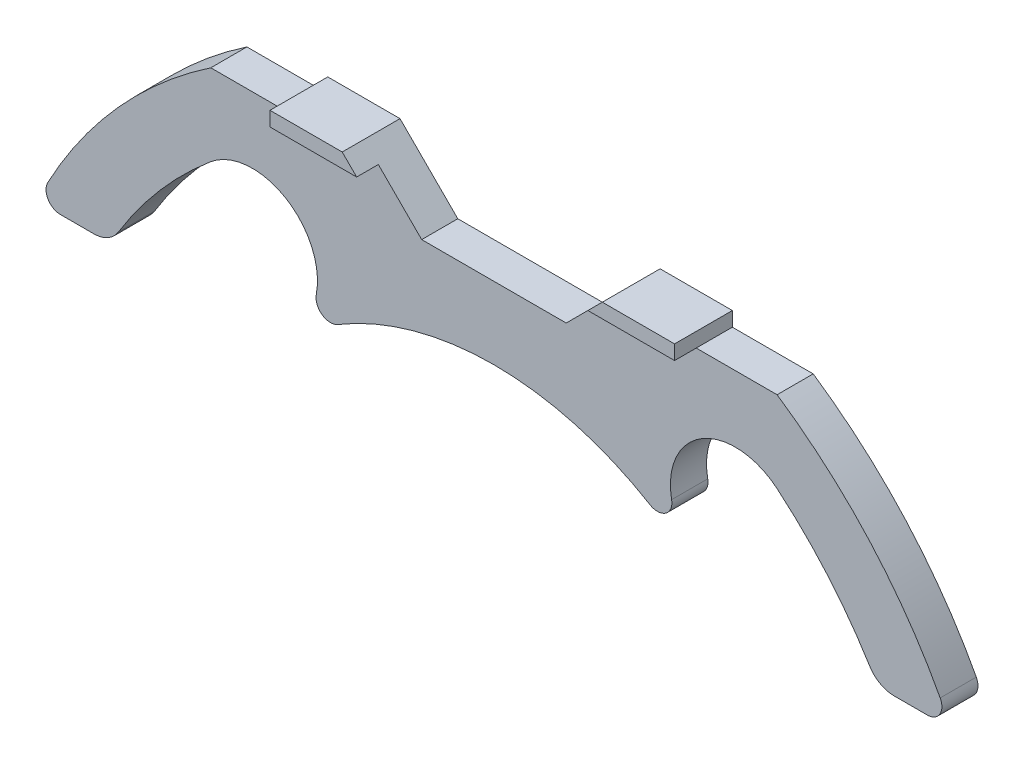
from build123d import *

# Parameters (mm, degrees)
EXTRUSION1_DEPTH = 1.25
EXTRUSION2_DEPTH = 4


with BuildPart() as part:
    # Esquisse1 → Extrusion1 (new, symmetric)
    with BuildSketch(Plane.XY):
        with BuildLine():
            Line((-19.595917942, 29), (-8, 29))
            Line((-8, 29), (-5, 26))
            Line((-5, 26), (5, 26))
            Line((5, 26), (8, 29))
            Line((8, 29), (19.595917942, 29))
            ThreePointArc((19.595917942, 29), (26.005009087, 23.425189484), (30.882352941, 16.470588235))
            ThreePointArc((30.882352941, 16.470588235), (30.857492926, 15.485504245), (30, 15))
            Line((30, 15), (27.699277969, 15))
            ThreePointArc((27.699277969, 15), (26.722627492, 15.254676578), (25.994707017, 15.953846154))
            ThreePointArc((25.994707017, 15.953846154), (23.098976948, 19.917009413), (19.605022095, 23.364355515))
            ThreePointArc((19.605022095, 23.364355515), (14.428703263, 23.794573944), (12.29508997, 19.058852366))
            ThreePointArc((12.29508997, 19.058852366), (11.88737091, 18.049208847), (10.799200573, 18.01047659))
            ThreePointArc((10.799200573, 18.01047659), (0, 21), (-10.799200573, 18.01047659))
            ThreePointArc((-10.799200573, 18.01047659), (-11.88737091, 18.049208847), (-12.29508997, 19.058852366))
            ThreePointArc((-12.29508997, 19.058852366), (-14.428703263, 23.794573944), (-19.605022095, 23.364355515))
            ThreePointArc((-19.605022095, 23.364355515), (-23.098976948, 19.917009413), (-25.994707017, 15.953846154))
            ThreePointArc((-25.994707017, 15.953846154), (-26.722627492, 15.254676578), (-27.699277969, 15))
            Line((-27.699277969, 15), (-30, 15))
            ThreePointArc((-30, 15), (-30.857492926, 15.485504245), (-30.882352941, 16.470588235))
            ThreePointArc((-30.882352941, 16.470588235), (-26.005009087, 23.425189484), (-19.595917942, 29))
        make_face()
    extrude(amount=EXTRUSION1_DEPTH, both=True)

    # Esquisse2 → Extrusion2 (add)
    with BuildSketch(Plane(origin=(0, 0, -1.25), x_dir=(-1, 0, 0), z_dir=(0, 0, -1))):
        Polygon((-8, 29), (-14, 29), (-14, 30), (-9, 30), align=None)
        Polygon((8, 29), (9, 30), (14, 30), (14, 29), align=None)
    extrude(amount=-EXTRUSION2_DEPTH)


solid = part.part
